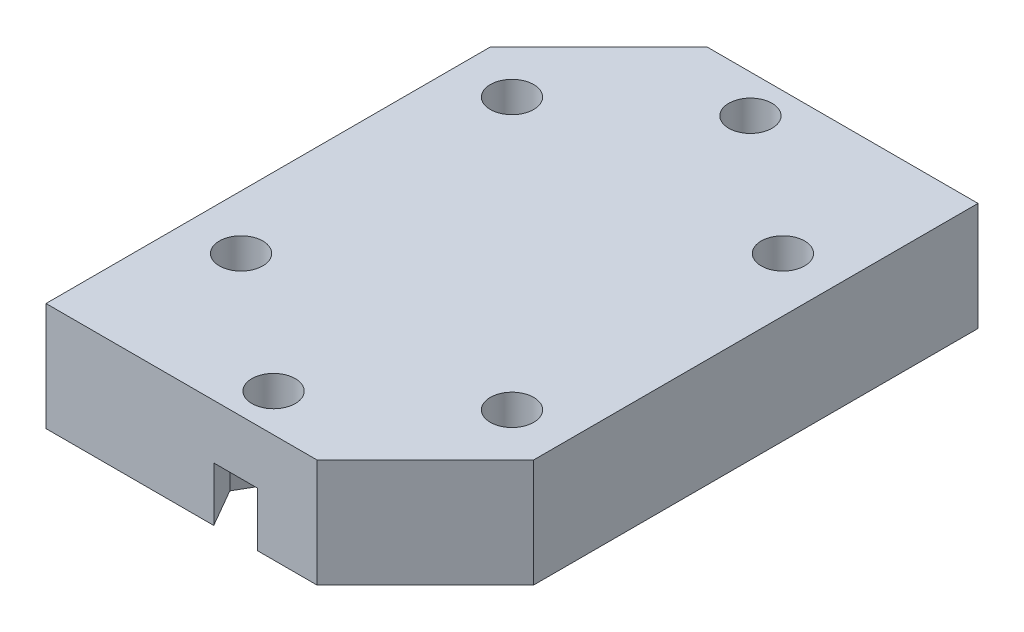
from build123d import *

# Parameters (mm, degrees)
SKETCH1_W           = 35
SKETCH1_H           = 51
SKETCH1_R           = 2
BOSS_EXTRUDE1_DEPTH = 10
CUT_EXTRUDE4_DEPTH  = 5
CUT_EXTRUDE5_DEPTH  = 33.503845926


with BuildPart() as part:
    # Sketch1 → Boss-Extrude1 (new body)
    with BuildSketch(Plane(origin=(0, 0, 0), x_dir=(1, 0, 0), z_dir=(0, 1, 0))):
        Rectangle(SKETCH1_W, SKETCH1_H)
        with Locations(Location((-12.5, 12.5, 0), (0, 0, 270))):
            Circle(SKETCH1_R, mode=Mode.SUBTRACT)
        with Locations(Location((12.5, 12.5, 0), (0, 0, 90))):
            Circle(SKETCH1_R, mode=Mode.SUBTRACT)
        with Locations(Location((12.5, -12.5, 0), (0, 0, 270))):
            Circle(SKETCH1_R, mode=Mode.SUBTRACT)
        with Locations(Location((-12.5, -12.5, 0), (0, 0, 90))):
            Circle(SKETCH1_R, mode=Mode.SUBTRACT)
        with Locations(Location((0, 22, 0), (0, 0, 270))):
            Circle(SKETCH1_R, mode=Mode.SUBTRACT)
        with Locations(Location((0, -22, 0), (0, 0, 90))):
            Circle(SKETCH1_R, mode=Mode.SUBTRACT)
    extrude(amount=BOSS_EXTRUDE1_DEPTH)

    # Sketch2 → Cut-Extrude4 (cut)
    with BuildSketch(Plane(origin=(0, 0, 0), x_dir=(1, 0, 0), z_dir=(0, 1, 0))):
        Polygon((4.041451884, 22), (2.020725942, 25.5), (-2.020725942, 25.5), (-4.041451884, 22), (-2.020725942, 18.5), (2.020725942, 18.5), align=None)
        Polygon((4.041451884, -22), (2.020725942, -18.5), (-2.020725942, -18.5), (-4.041451884, -22), (-2.020725942, -25.5), (2.020725942, -25.5), align=None)
    extrude(amount=CUT_EXTRUDE4_DEPTH, mode=Mode.SUBTRACT)

    # Sketch4 → Cut-Extrude5 (cut, through all)
    with BuildSketch(Plane(origin=(0, 0, 0), x_dir=(1, 0, 0), z_dir=(0, 1, 0))):
        Polygon((-7.5, 25.5), (-17.5, 15.5), (-17.5, 25.5), align=None)
        Polygon((17.5, -15.5), (7.5, -25.5), (17.5, -25.5), align=None)
    extrude(amount=CUT_EXTRUDE5_DEPTH, mode=Mode.SUBTRACT)


solid = part.part
